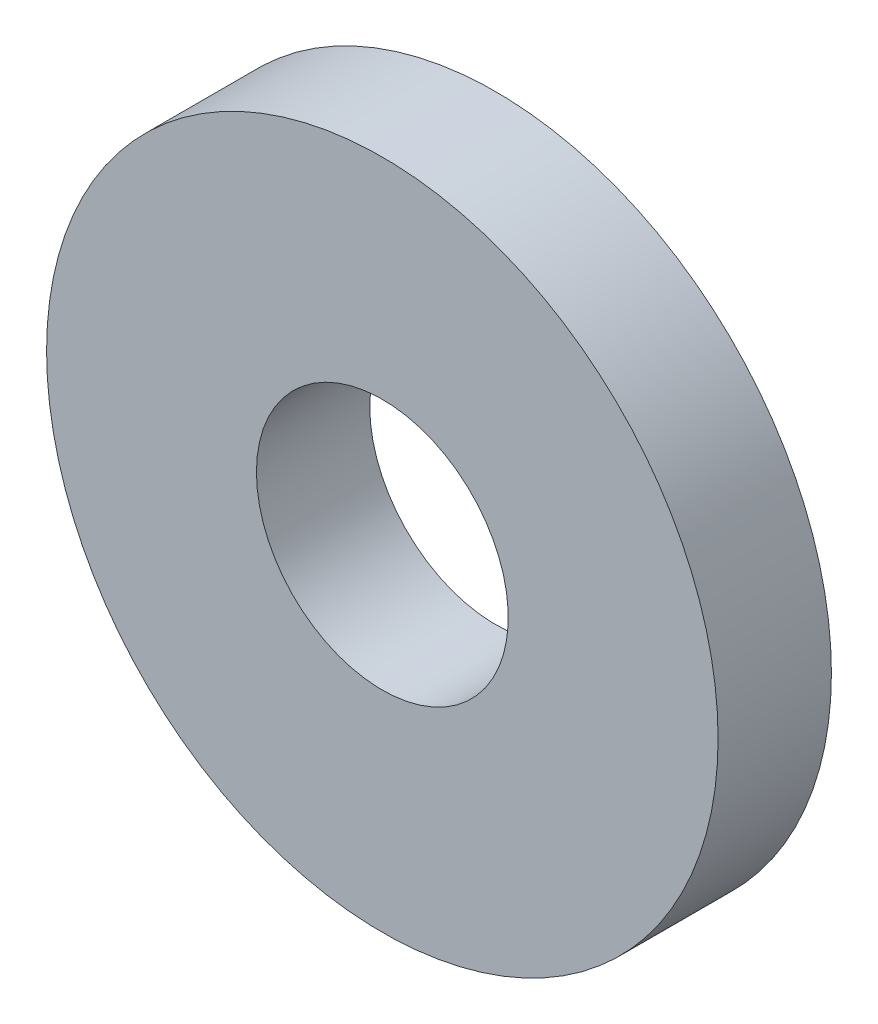
from build123d import *

# Parameters (mm, degrees)
SKICA1_R                = 16
SKICA1_R_2              = 6
P_IDAT_VYSUNUT_M1_DEPTH = 5.4


with BuildPart() as part:
    # Skica1 → Přidat vysunutím1 (new body)
    with BuildSketch(Plane.XY):
        with Locations(Location((0, 0, 0), (0, 0, 180))):
            Circle(SKICA1_R)
        with Locations(Location((0, 0, 0), (0, 0, 180))):
            Circle(SKICA1_R_2, mode=Mode.SUBTRACT)
    extrude(amount=P_IDAT_VYSUNUT_M1_DEPTH)


solid = part.part
